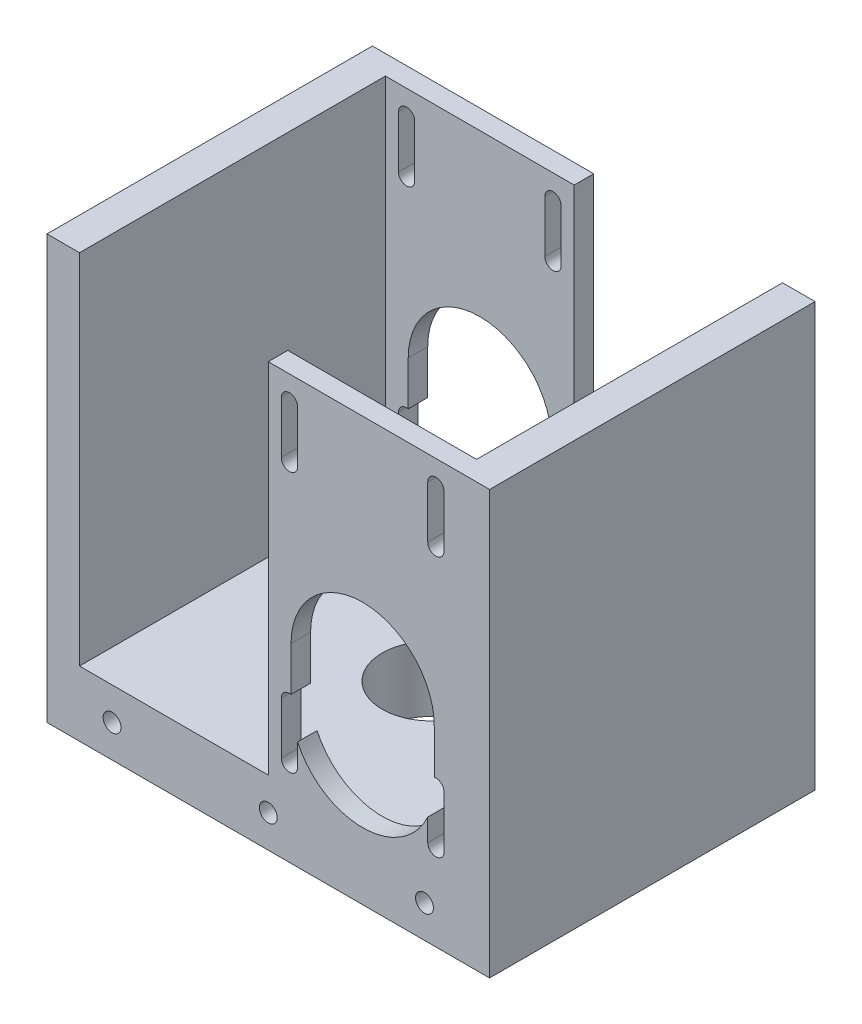
from build123d import *

# Parameters (mm, degrees)
BOSS_EXTRUDE1_DEPTH      = 25
BOSS_EXTRUDE1_DEPTH_BACK = 25
SKETCH1_W                = 5
SKETCH1_H                = 55
SKETCH1_W_2              = 68
SKETCH1_H_2              = 10
SKETCH2_W                = 29
SKETCH2_H                = 3
BOSS_EXTRUDE2_DEPTH      = 55
SKETCH4_R                = 7.5
CUT_EXTRUDE2_DEPTH       = 12
SKETCH6_R                = 1.375
CUT_EXTRUDE4_DEPTH       = 70
CUT_EXTRUDE11_DEPTH      = 61
SKETCH9_W                = 22
SKETCH9_H                = 5.846779426
CUT_EXTRUDE12_DEPTH      = 70


with BuildPart() as part:
    # Sketch1 → Boss-Extrude1 (new, two sides: drawn at the far end of the back side and taken through both)
    with BuildSketch(Plane.XY.offset(-BOSS_EXTRUDE1_DEPTH_BACK)):
        with Locations((-31.5, 32.5)):
            Rectangle(SKETCH1_W, SKETCH1_H)
        Rectangle(SKETCH1_W_2, SKETCH1_H_2)
        with Locations((31.5, 32.5)):
            Rectangle(SKETCH1_W, SKETCH1_H)
    extrude(amount=BOSS_EXTRUDE1_DEPTH + BOSS_EXTRUDE1_DEPTH_BACK)

    # Sketch2 → Boss-Extrude2 (add)
    with BuildSketch(Plane(origin=(0, 5, 0), x_dir=(1, 0, 0), z_dir=(0, 1, 0))):
        with Locations((14.5, -23.5)):
            Rectangle(SKETCH2_W, SKETCH2_H)
        with Locations((-14.5, 23.5)):
            Rectangle(SKETCH2_W, SKETCH2_H)
    extrude(amount=BOSS_EXTRUDE2_DEPTH)

    # Sketch4 → Cut-Extrude2 (cut)
    with BuildSketch(Plane(origin=(0, 5, 0), x_dir=(1, 0, 0), z_dir=(0, 1, 0))):
        with Locations(Location((0, 0, 0), (0, 0, 180))):
            Circle(SKETCH4_R)
    extrude(amount=-CUT_EXTRUDE2_DEPTH, mode=Mode.SUBTRACT)

    # Sketch6 → Cut-Extrude4 (cut)
    with BuildSketch(Plane.XY.offset(25)):
        Circle(SKETCH6_R)
        with Locations((24, 0)):
            Circle(SKETCH6_R)
        with Locations((-24, 0)):
            Circle(SKETCH6_R)
    extrude(amount=-CUT_EXTRUDE4_DEPTH, mode=Mode.SUBTRACT)

    # Sketch3 → Cut-Extrude11 (cut)
    with BuildSketch(Plane(origin=(0, 0, -25), x_dir=(-1, 0, 0), z_dir=(0, 0, -1))):
        with BuildLine():
            Line((25.5, 17.474744871), (25.5, 24.25))
            ThreePointArc((25.5, 24.25), (14.5, 35.25), (3.5, 24.25))
            Line((3.5, 24.25), (3.5, 17.474744871))
            ThreePointArc((3.5, 17.474744871), (2.459430585, 17.218245837), (2, 16.25))
            Line((2, 16.25), (2, 8.25))
            ThreePointArc((2, 8.25), (3.25, 7), (4.5, 8.25))
            Line((4.5, 8.25), (4.5, 11.667424305))
            ThreePointArc((4.5, 11.667424305), (14.5, 5.25), (24.5, 11.667424305))
            Line((24.5, 11.667424305), (24.5, 8.25))
            ThreePointArc((24.5, 8.25), (25.75, 7), (27, 8.25))
            Line((27, 8.25), (27, 16.25))
            ThreePointArc((27, 16.25), (26.540569415, 17.218245837), (25.5, 17.474744871))
        make_face()
        with BuildLine():
            Line((4.5, 48.25), (4.5, 56.25))
            ThreePointArc((4.5, 56.25), (3.25, 57.5), (2, 56.25))
            Line((2, 56.25), (2, 48.25))
            ThreePointArc((2, 48.25), (3.25, 47), (4.5, 48.25))
        make_face()
        with BuildLine():
            Line((27, 48.25), (27, 56.25))
            ThreePointArc((27, 56.25), (25.75, 57.5), (24.5, 56.25))
            Line((24.5, 56.25), (24.5, 48.25))
            ThreePointArc((24.5, 48.25), (25.75, 47), (27, 48.25))
        make_face()
    cut_extrude11 = extrude(amount=-CUT_EXTRUDE11_DEPTH, mode=Mode.SUBTRACT)

    # Sketch9 → Cut-Extrude12 (cut)
    with BuildSketch(Plane(origin=(0, 0, -25), x_dir=(-1, 0, 0), z_dir=(0, 0, -1))):
        with Locations((14.5, 14.551355158)):
            Rectangle(SKETCH9_W, SKETCH9_H)
    extrude(amount=-CUT_EXTRUDE12_DEPTH, mode=Mode.SUBTRACT)

    # Mirror3: Cut-Extrude11 across plane
    add(cut_extrude11.mirror(Plane(origin=(0, 0, 0), x_dir=(0, 0, 1), z_dir=(1, 0, 0))), mode=Mode.SUBTRACT)


solid = part.part
